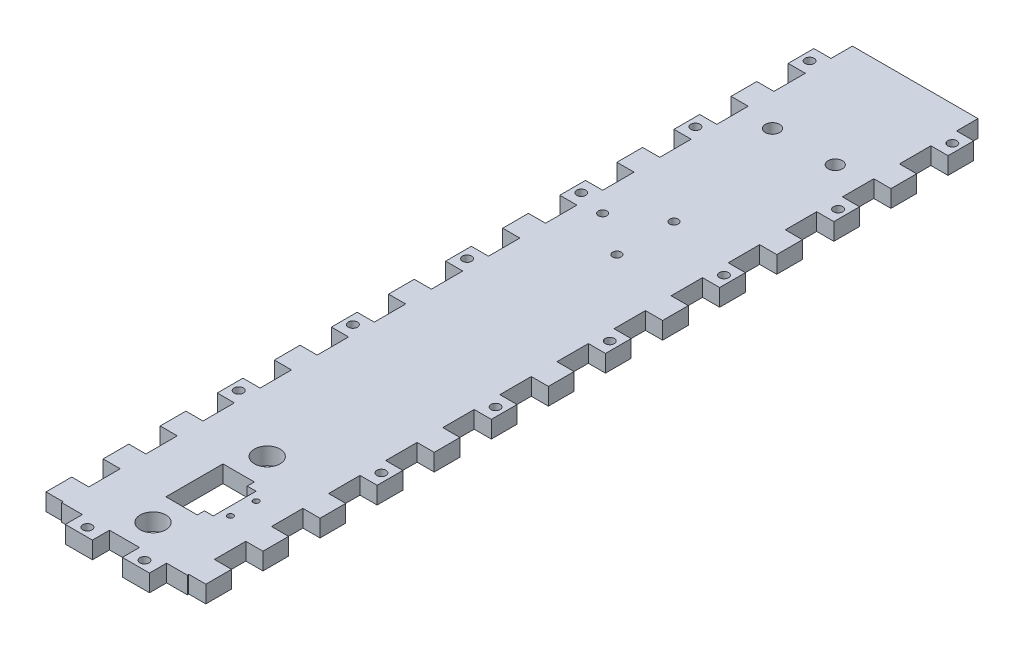
from build123d import *

# Parameters (mm, degrees)
SKETCH1_W               = 44
SKETCH1_H               = 6
BOSS_EXTRUDE1_DEPTH     = 277
SKETCH4_W               = 9
SKETCH4_H               = 6
BOSS_EXTRUDE2_DEPTH     = 6
SKETCH5_W               = 9
SKETCH5_H               = 6
BOSS_EXTRUDE3_DEPTH     = 6
SKETCH6_W               = 9.5
SKETCH6_H               = 6
BOSS_EXTRUDE4_DEPTH     = 6
SKETCH7_R               = 1.6
CUT_EXTRUDE1_DEPTH      = 286.346184868
SKETCH8_R               = 2.5
CUT_EXTRUDE2_DEPTH      = 12
SKETCH9_R               = 1.6
CUT_EXTRUDE3_DEPTH      = 12
SKETCH11_W              = 11
SKETCH11_H              = 20
SKETCH11_W_2            = 3.1
SKETCH11_H_2            = 15
SKETCH11_R              = 4.5
SKETCH11_R_2            = 1
CUT_EXTRUDE4_DEPTH      = 286.346184868
SKETCH7_2_R             = 1.6
BOSS_EXTRUDE5_DEPTH     = 6
CUT_EXTRUDE5_DEPTH      = 286.346184868
CUT_EXTRUDE5_DEPTH_BACK = 286.346184868
SKETCH12_R              = 1.5


with BuildPart() as part:
    # Sketch1 → Boss-Extrude1 (new body)
    with BuildSketch(Plane.XY):
        with Locations((-8.02006689, 7.52173913)):
            Rectangle(SKETCH1_W, SKETCH1_H)
    extrude(amount=BOSS_EXTRUDE1_DEPTH)

    # Sketch4 → Boss-Extrude2 (add)
    with BuildSketch(Plane(origin=(13.97993311, 0, 0), x_dir=(0, 0, -1), z_dir=(1, 0, 0))):
        with Locations((-272, 7.52173913)):
            Rectangle(SKETCH4_W, SKETCH4_H)
        with Locations((-252, 7.52173913)):
            Rectangle(SKETCH4_W, SKETCH4_H)
        with Locations((-232, 7.52173913)):
            Rectangle(SKETCH4_W, SKETCH4_H)
        with Locations((-212, 7.52173913)):
            Rectangle(SKETCH4_W, SKETCH4_H)
        with Locations((-192, 7.52173913)):
            Rectangle(SKETCH4_W, SKETCH4_H)
        with Locations((-172, 7.52173913)):
            Rectangle(SKETCH4_W, SKETCH4_H)
        with Locations((-152, 7.52173913)):
            Rectangle(SKETCH4_W, SKETCH4_H)
        with Locations((-132, 7.52173913)):
            Rectangle(SKETCH4_W, SKETCH4_H)
        with Locations((-112, 7.52173913)):
            Rectangle(SKETCH4_W, SKETCH4_H)
        with Locations((-92, 7.52173913)):
            Rectangle(SKETCH4_W, SKETCH4_H)
        with Locations((-72, 7.52173913)):
            Rectangle(SKETCH4_W, SKETCH4_H)
        with Locations((-52, 7.52173913)):
            Rectangle(SKETCH4_W, SKETCH4_H)
        with Locations((-32, 7.52173913)):
            Rectangle(SKETCH4_W, SKETCH4_H)
        with Locations((-12, 7.52173913)):
            Rectangle(SKETCH4_W, SKETCH4_H)
    extrude(amount=BOSS_EXTRUDE2_DEPTH)

    # Sketch5 → Boss-Extrude3 (add)
    with BuildSketch(Plane.ZY.offset(30.02006689)):
        with Locations((272, 7.52173913)):
            Rectangle(SKETCH5_W, SKETCH5_H)
        with Locations((252, 7.52173913)):
            Rectangle(SKETCH5_W, SKETCH5_H)
        with Locations((232, 7.52173913)):
            Rectangle(SKETCH5_W, SKETCH5_H)
        with Locations((212, 7.52173913)):
            Rectangle(SKETCH5_W, SKETCH5_H)
        with Locations((192, 7.52173913)):
            Rectangle(SKETCH5_W, SKETCH5_H)
        with Locations((172, 7.52173913)):
            Rectangle(SKETCH5_W, SKETCH5_H)
        with Locations((152, 7.52173913)):
            Rectangle(SKETCH5_W, SKETCH5_H)
        with Locations((132, 7.52173913)):
            Rectangle(SKETCH5_W, SKETCH5_H)
        with Locations((112, 7.52173913)):
            Rectangle(SKETCH5_W, SKETCH5_H)
        with Locations((92, 7.52173913)):
            Rectangle(SKETCH5_W, SKETCH5_H)
        with Locations((72, 7.52173913)):
            Rectangle(SKETCH5_W, SKETCH5_H)
        with Locations((52, 7.52173913)):
            Rectangle(SKETCH5_W, SKETCH5_H)
        with Locations((32, 7.52173913)):
            Rectangle(SKETCH5_W, SKETCH5_H)
        with Locations((12, 7.52173913)):
            Rectangle(SKETCH5_W, SKETCH5_H)
    extrude(amount=BOSS_EXTRUDE3_DEPTH)

    # Sketch6 → Boss-Extrude4 (add)
    with BuildSketch(Plane.XY.offset(277)):
        with Locations((-18.02006689, 7.52173913)):
            Rectangle(SKETCH6_W, SKETCH6_H)
        with Locations((1.97993311, 7.52173913)):
            Rectangle(SKETCH6_W, SKETCH6_H)
    extrude(amount=BOSS_EXTRUDE4_DEPTH)

    # Sketch7 → Cut-Extrude1 (cut, through all)
    with BuildSketch(Plane.XZ.offset(-4.52173913)):
        with Locations(Location((16.97993311, 252, 0), (0, 0, 270))):
            Circle(SKETCH7_R)
        with Locations(Location((-33.02006689, 252, 0), (0, 0, 90))):
            Circle(SKETCH7_R)
        with Locations(Location((-33.02006689, 212, 0), (0, 0, 90))):
            Circle(SKETCH7_R)
        with Locations(Location((16.97993311, 212, 0), (0, 0, 270))):
            Circle(SKETCH7_R)
        with Locations(Location((-33.02006689, 172, 0), (0, 0, 90))):
            Circle(SKETCH7_R)
        with Locations(Location((16.97993311, 172, 0), (0, 0, 270))):
            Circle(SKETCH7_R)
        with Locations(Location((-33.02006689, 132, 0), (0, 0, 90))):
            Circle(SKETCH7_R)
        with Locations(Location((16.97993311, 132, 0), (0, 0, 270))):
            Circle(SKETCH7_R)
        with Locations(Location((-33.02006689, 92, 0), (0, 0, 90))):
            Circle(SKETCH7_R)
        with Locations(Location((16.97993311, 92, 0), (0, 0, 270))):
            Circle(SKETCH7_R)
        with Locations(Location((-33.02006689, 52, 0), (0, 0, 90))):
            Circle(SKETCH7_R)
        with Locations(Location((16.97993311, 52, 0), (0, 0, 270))):
            Circle(SKETCH7_R)
        with Locations(Location((-33.02006689, 12, 0), (0, 0, 90))):
            Circle(SKETCH7_R)
        with Locations(Location((16.97993311, 12, 0), (0, 0, 270))):
            Circle(SKETCH7_R)
    extrude(amount=-CUT_EXTRUDE1_DEPTH, mode=Mode.SUBTRACT)

    # Sketch8 → Cut-Extrude2 (cut)
    with BuildSketch(Plane.XZ.offset(-4.52173913)):
        with Locations(Location((-19.02006689, 39, 0), (0, 0, 270))):
            Circle(SKETCH8_R)
        with Locations(Location((2.97993311, 39, 0), (0, 0, 270))):
            Circle(SKETCH8_R)
    extrude(amount=-CUT_EXTRUDE2_DEPTH, mode=Mode.SUBTRACT)

    # Sketch9 → Cut-Extrude3 (cut)
    with BuildSketch(Plane(origin=(0, 4.52173913, 0), x_dir=(-1, 0, 0), z_dir=(0, -1, 0))):
        with Locations(Location((18.02006689, -280, 0), (0, 0, 90))):
            Circle(SKETCH9_R)
        with Locations(Location((-1.97993311, -280, 0), (0, 0, 90))):
            Circle(SKETCH9_R)
    extrude(amount=-CUT_EXTRUDE3_DEPTH, mode=Mode.SUBTRACT)

    # Sketch11 → Cut-Extrude4 (cut, through all)
    with BuildSketch(Plane.XZ.offset(-4.52173913)):
        with Locations((-8.02006689, 247)):
            Rectangle(SKETCH11_W, SKETCH11_H)
        with Locations((-0.97006689, 247)):
            Rectangle(SKETCH11_W_2, SKETCH11_H_2)
        with Locations(Location((-8.02006689, 267, 0), (0, 0, 270))):
            Circle(SKETCH11_R)
        with Locations(Location((-8.02006689, 227, 0), (0, 0, 270))):
            Circle(SKETCH11_R)
        with Locations(Location((3.57993311, 251.5, 0), (0, 0, 270))):
            Circle(SKETCH11_R_2)
        with Locations(Location((3.57993311, 242.5, 0), (0, 0, 270))):
            Circle(SKETCH11_R_2)
    extrude(amount=-CUT_EXTRUDE4_DEPTH, mode=Mode.SUBTRACT)

    # Sketch7<2> → Boss-Extrude5 (add, through all)
    with BuildSketch(Plane.XZ.offset(-4.52173913)):
        with Locations((-33.02006689, 252)):
            Circle(SKETCH7_2_R)
        with Locations((16.97993311, 252)):
            Circle(SKETCH7_2_R)
    extrude(amount=-BOSS_EXTRUDE5_DEPTH)

    # Sketch12 → Cut-Extrude5 (cut, two sides: drawn at the far end of the back side and taken through both)
    with BuildSketch(Plane(origin=(0, 10.52173913, 0), x_dir=(1, 0, 0), z_dir=(0, 1, 0)).offset(-CUT_EXTRUDE5_DEPTH_BACK)):
        with Locations(Location((-8.02006689, -104.5, 0), (0, 0, 270))):
            Circle(SKETCH12_R)
        with Locations(Location((-8.02006689, -84.5, 0), (0, 0, 270))):
            Circle(SKETCH12_R)
        with Locations(Location((-23.02006689, -94.5, 0), (0, 0, 270))):
            Circle(SKETCH12_R)
    extrude(amount=CUT_EXTRUDE5_DEPTH + CUT_EXTRUDE5_DEPTH_BACK, mode=Mode.SUBTRACT)


solid = part.part
